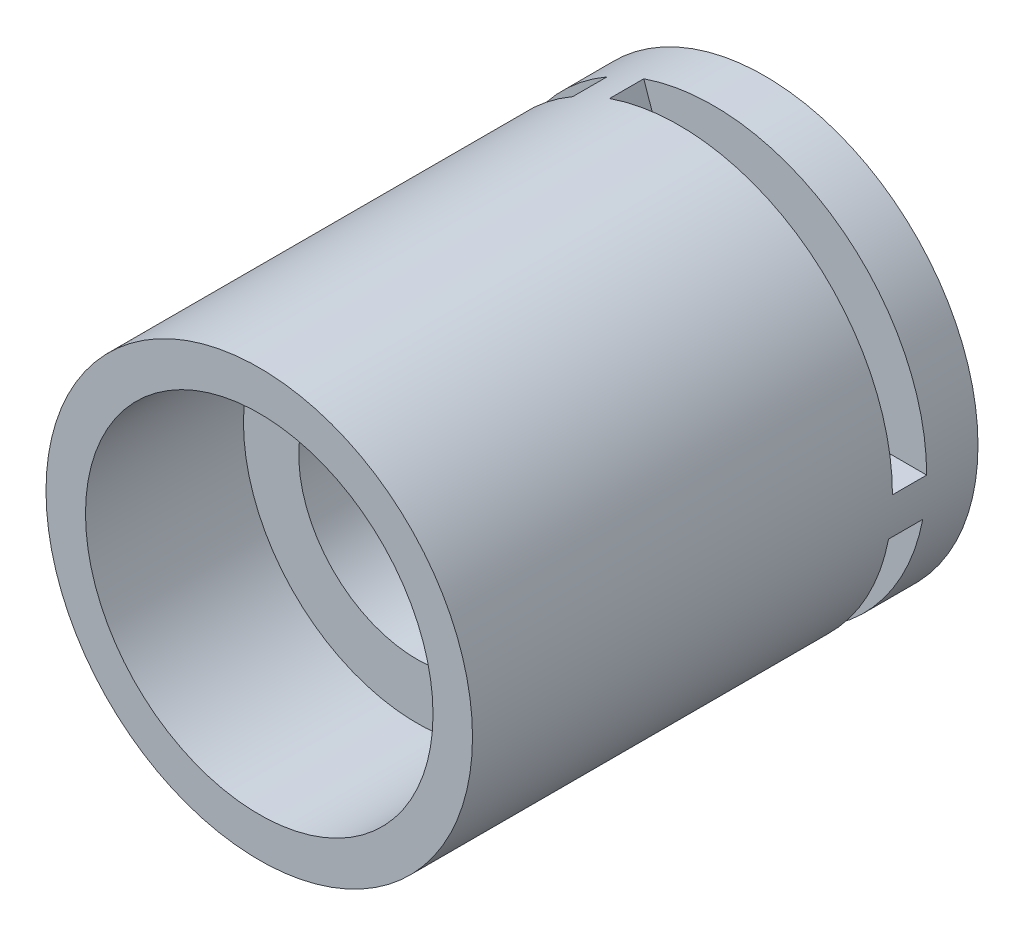
from build123d import *

# Parameters (mm, degrees)
SKETCH2_R           = 13.5
BOSS_EXTRUDE1_DEPTH = 32
SKETCH4_R           = 11
CUT_EXTRUDE1_DEPTH  = 10
SKETCH5_R           = 7.5
CUT_EXTRUDE2_DEPTH  = 30
WRAP1_SECTION_W     = 12
WRAP1_SECTION_H     = 2.166
WRAP1_ANGLE         = 109.116628984
CIRPATTERN1_COUNT   = 3


with BuildPart() as part:
    # Sketch2 → Boss-Extrude1 (new body)
    with BuildSketch(Plane.XY):
        Circle(SKETCH2_R)
    extrude(amount=-BOSS_EXTRUDE1_DEPTH)

    # Sketch4 → Cut-Extrude1 (cut)
    with BuildSketch(Plane.XY):
        Circle(SKETCH4_R)
    extrude(amount=-CUT_EXTRUDE1_DEPTH, mode=Mode.SUBTRACT)

    # Sketch5 → Cut-Extrude2 (cut)
    with BuildSketch(Plane.XY):
        Circle(SKETCH5_R)
    extrude(amount=-CUT_EXTRUDE2_DEPTH, mode=Mode.SUBTRACT)

    # Wrap1 section (on wrap section) → Wrap1 (revolve, cut)
    with BuildSketch(Plane(origin=(0, 0, 0), x_dir=(0.9999995414170643, -0.0009576876636740589, 0), z_dir=(-0.0009576876636740589, -0.9999995414170643, 0))):
        with Locations((7.5, -27.667)):
            Rectangle(WRAP1_SECTION_W, WRAP1_SECTION_H)
    wrap1 = revolve(axis=Axis((0, 0, 0), (0, 0, 1)), revolution_arc=WRAP1_ANGLE, mode=Mode.SUBTRACT)

    # CirPattern1: Wrap1 ×3 about axis
    cirpattern1_axis = Axis((0, 0, 0), (0, 0, 1))
    for i in range(1, CIRPATTERN1_COUNT):
        add(wrap1.rotate(cirpattern1_axis, i * 360 / CIRPATTERN1_COUNT), mode=Mode.SUBTRACT)


solid = part.part
